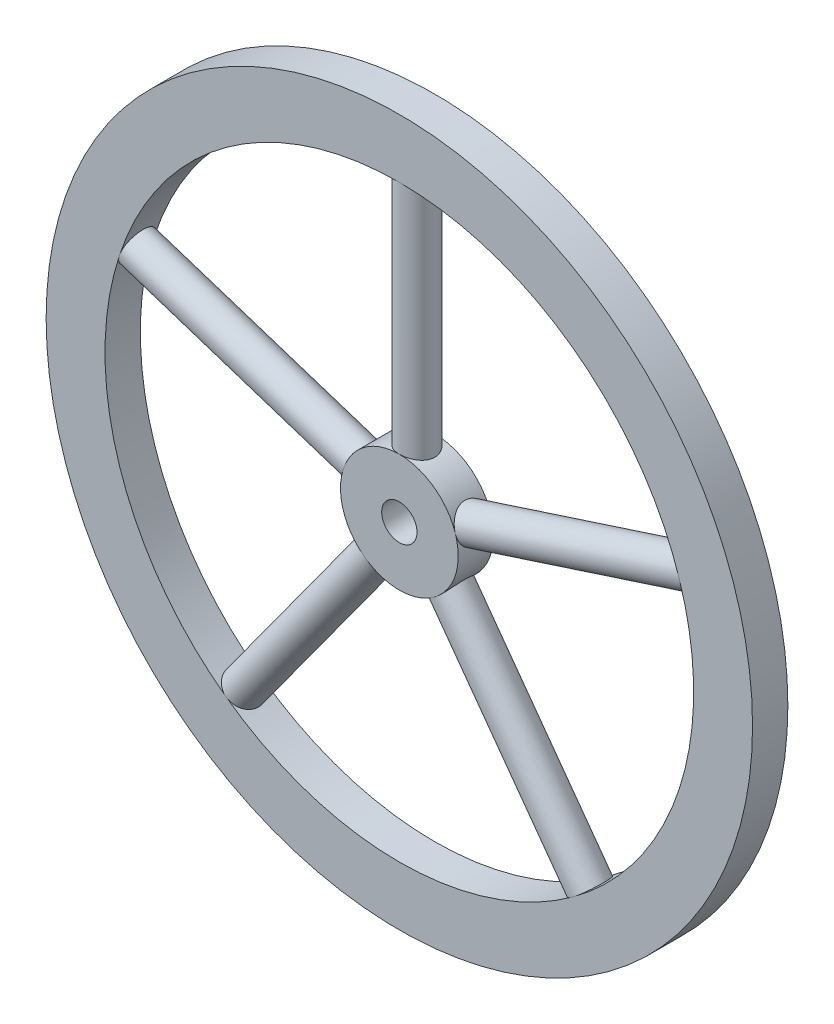
from build123d import *

# Parameters (mm, degrees)
SKETCH1_R             = 300
SKETCH1_R_2           = 250
BOSS_EXTRUDE1_DEPTH   = 15
SKETCH1_R_3           = 50
SKETCH1_R_4           = 15
BOSS_EXTRUDE1_2_DEPTH = 15
SKETCH2_W             = 15
SKETCH2_H             = 228.838345423
CIRPATTERN1_COUNT     = 5


with BuildPart() as part:
    # Sketch1 → Boss-Extrude1 (new, symmetric)
    with BuildSketch(Plane.XY):
        Circle(SKETCH1_R)
        Circle(SKETCH1_R_2, mode=Mode.SUBTRACT)
    extrude(amount=BOSS_EXTRUDE1_DEPTH, both=True)



with BuildPart() as body_2:
    # Sketch1 → Boss-Extrude1 2 (new, symmetric)
    with BuildSketch(Plane.XY):
        Circle(SKETCH1_R_3)
        Circle(SKETCH1_R_4, mode=Mode.SUBTRACT)
    extrude(amount=BOSS_EXTRUDE1_2_DEPTH, both=True)


with BuildPart() as part_1:
    add(part.part)

    add(body_2.part)  # Revolve1 merges body 2
    # Sketch2 → Revolve1 (revolve)
    with BuildSketch(Plane.XY, mode=Mode.PRIVATE) as revolve1_sk:
        with Locations((7.5, 150.832405889)):
            Rectangle(SKETCH2_W, SKETCH2_H)
    revolve1 = revolve(revolve1_sk.sketch.rotate(Axis((0, 0, 0), (0, 1, 0)), 270), axis=Axis((0, 0, 0), (0, 1, 0)))

    # CirPattern1: Revolve1 ×5 about axis
    cirpattern1_axis = Axis((0, 0, 15), (0, 0, -1))
    for i in range(1, CIRPATTERN1_COUNT):
        add(revolve1.rotate(cirpattern1_axis, i * 360 / CIRPATTERN1_COUNT))


solid = part_1.part
